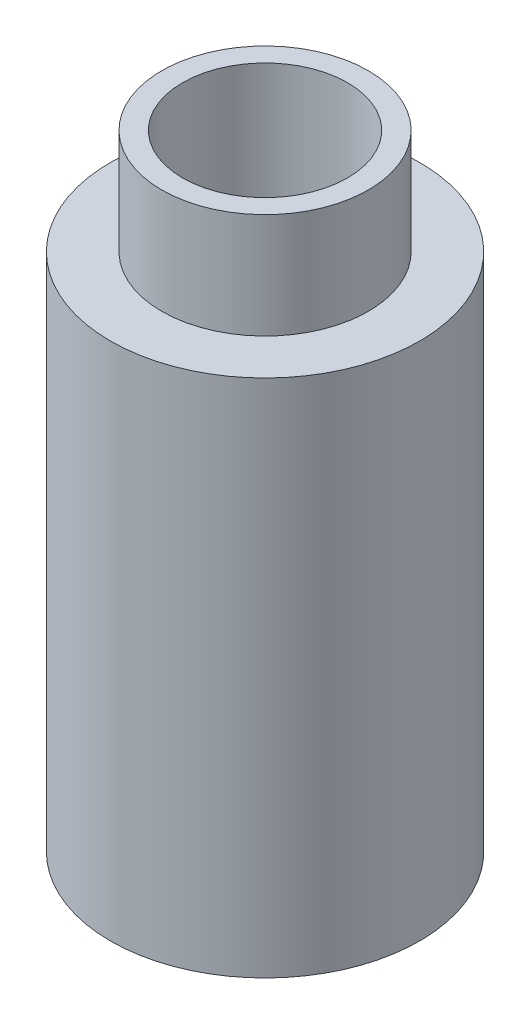
from build123d import *

# Parameters (mm, degrees)
SKETCH1_R           = 9.4488
BOSS_EXTRUDE1_DEPTH = 31.75
SKETCH2_R           = 6.3119
BOSS_EXTRUDE2_DEPTH = 6.4262
SKETCH3_R           = 5.0419
CUT_EXTRUDE1_DEPTH  = 41.447272953


with BuildPart() as part:
    # Sketch1 → Boss-Extrude1 (new body)
    with BuildSketch(Plane(origin=(0, 0, 0), x_dir=(1, 0, 0), z_dir=(0, 1, 0))):
        with Locations(Location((0, 0, 0), (0, 0, 270))):
            Circle(SKETCH1_R)
    extrude(amount=BOSS_EXTRUDE1_DEPTH)

    # Sketch2 → Boss-Extrude2 (add)
    with BuildSketch(Plane(origin=(0, 31.75, 0), x_dir=(1, 0, 0), z_dir=(0, 1, 0))):
        with Locations(Location((0, 0, 0), (0, 0, 270))):
            Circle(SKETCH2_R)
    extrude(amount=BOSS_EXTRUDE2_DEPTH)

    # Sketch3 → Cut-Extrude1 (cut, through all)
    with BuildSketch(Plane(origin=(0, 38.1762, 0), x_dir=(1, 0, 0), z_dir=(0, 1, 0))):
        with Locations(Location((0, 0, 0), (0, 0, 270))):
            Circle(SKETCH3_R)
    extrude(amount=-CUT_EXTRUDE1_DEPTH, mode=Mode.SUBTRACT)


solid = part.part
